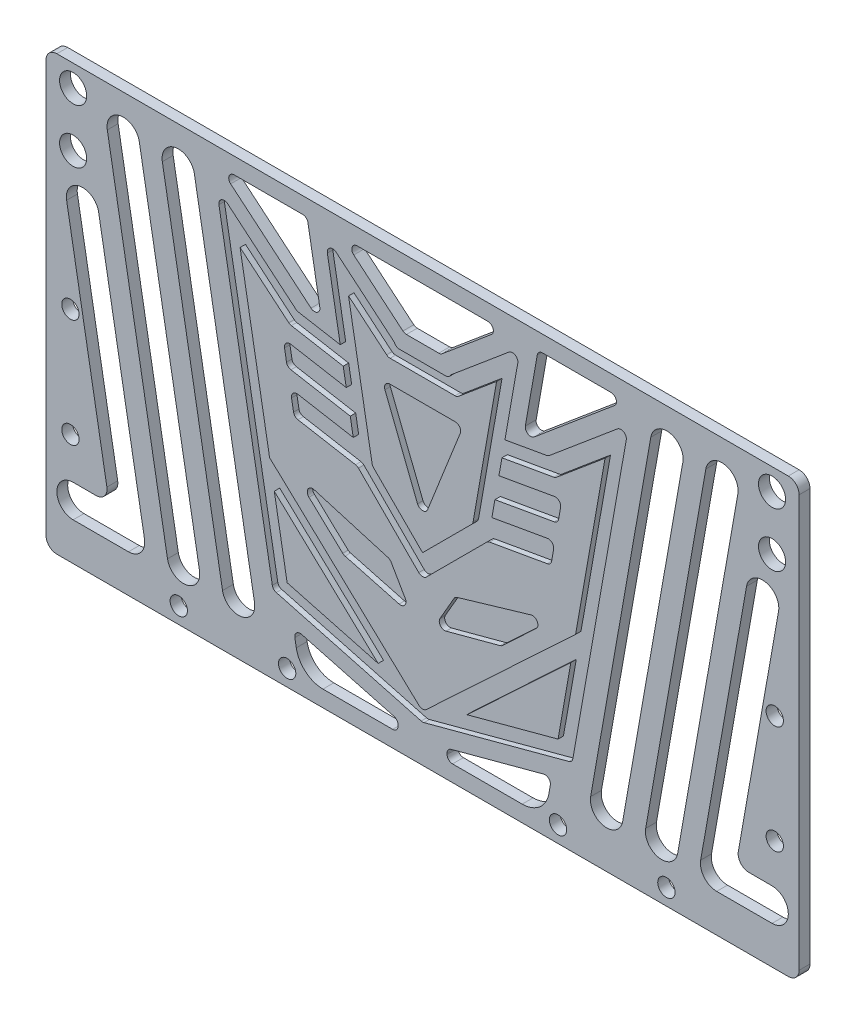
from build123d import *

# Parameters (mm, degrees)
SKETCH_1_W           = 139
SKETCH_1_H           = 80
EXTRUDE_1_DEPTH      = 2
SKETCH_2_R           = 1.6
CUT_EXTRUDE_1_DEPTH  = 10
CUT_EXTRUDE_4_DEPTH  = 10
CUT_EXTRUDE_6_DEPTH  = 10
SKETCH_12_R          = 2.5
CUT_EXTRUDE_7_DEPTH  = 10
FILLET_2_R           = 1
EXTRUDE_7_DEPTH      = 1
CUT_EXTRUDE_9_DEPTH  = 1
FILLET_6_R           = 1
FILLET_7_R           = 2
CUT_EXTRUDE_11_DEPTH = 10
FILLET_8_R           = 5
SKETCH_20_R          = 1.6
CUT_EXTRUDE_12_DEPTH = 10


with BuildPart() as part:
    # 草图1 → 凸台-拉伸1 (new body)
    with BuildSketch(Plane.XY):
        Rectangle(SKETCH_1_W, SKETCH_1_H)
    extrude(amount=EXTRUDE_1_DEPTH)

    # 草图2 → 切除-拉伸1 (cut)
    with BuildSketch(Plane(origin=(0, 0, 0), x_dir=(-1, 0, 0), z_dir=(0, 0, -1))):
        with Locations((-45, -37)):
            Circle(SKETCH_2_R)
        with Locations((-25, -37)):
            Circle(SKETCH_2_R)
        with Locations((25, -37)):
            Circle(SKETCH_2_R)
        with Locations((45, -37)):
            Circle(SKETCH_2_R)
    extrude(amount=-CUT_EXTRUDE_1_DEPTH, mode=Mode.SUBTRACT)

    # 草图8 → 切除-拉伸4 (cut)
    with BuildSketch(Plane.XY.offset(2)):
        Polygon((-2.050454401, -29.450582399), (-28.237299267, -4.94163371), (-27.369578226, -9.862724273), (-8.201817605, -27.802329596), align=None)
        Polygon((28.237299267, -4.94163371), (2.050454401, -29.450582399), (8.201817605, -27.802329596), (27.369578226, -9.862724273), align=None)
        Polygon((-6.000453282, -10.072058492), (-2, -17), (-14.557255853, -13.636173987), (-24.048690454, -4.752893669), align=None)
        Polygon((24.048690454, -4.752893669), (6.000453282, -10.072058492), (2, -17), (14.557255853, -13.636173987), align=None)
        Polygon((-12.056264909, 1.813624222), (-12.795435032, 6.005666305), (-24.436994042, 8.058387256), (-23.697823918, 3.866345173), align=None)
        Polygon((-13.349812625, 9.149697868), (-14.088982749, 13.341739952), (-25.730541758, 15.394460903), (-24.991371635, 11.202418819), align=None)
        Polygon((12.795435032, 6.005666305), (12.056264909, 1.813624222), (23.697823918, 3.866345173), (24.436994042, 8.058387256), align=None)
        Polygon((25.730541758, 15.394460903), (14.088982749, 13.341739952), (13.349812625, 9.149697868), (24.991371635, 11.202418819), align=None)
        Polygon((-11.5, 15.935200607), (-14.644031563, 16.4895782), (-14.088982749, 13.341739952), (-13.349812625, 9.149697868), (-12.795435032, 6.005666305), (-12.056264909, 1.813624222), (0, -10.242640687), (12.056264909, 1.813624222), (12.795435032, 6.005666305), (13.349812625, 9.149697868), (14.088982749, 13.341739952), (14.644031563, 16.4895782), (11.5, 15.935200607), (9.26609483, 3.26609483), (0, -6), (-9.26609483, 3.26609483), align=None)
        Polygon((-30.871912426, 10), (-33.682408883, 25.939117461), (-24.489875566, 18.225666145), (-14.644031563, 16.4895782), (-11.5, 15.935200607), (-12.054377593, 19.07923217), (-15.198409155, 19.633609762), (-23.177295707, 21.040502737), (-38.068115484, 33.53538412), (-33.918192262, 10), align=None)
        Polygon((33.682408883, 25.939117461), (30.871912426, 10), (33.918192262, 10), (38.068115484, 33.53538412), (23.177295707, 21.040502737), (15.198409155, 19.633609762), (12.054377593, 19.07923217), (11.5, 15.935200607), (14.644031563, 16.4895782), (24.489875566, 18.225666145), align=None)
        Polygon((-2.050454401, -32.55641094), (-2.050454401, -29.450582399), (-8.201817605, -27.802329596), (-25, -23.301270189), (-24.425201305, -26.561115577), align=None)
        Polygon((8.201817605, -27.802329596), (2.050454401, -29.450582399), (2.050454401, -32.55641094), (24.425201305, -26.561115577), (25, -23.301270189), align=None)
        Polygon((-27.369578226, -9.862724273), (-28.237299267, -4.94163371), (-31.885665318, -1.527033105), (-29.157363783, -17), (-26.111083947, -17), align=None)
        Polygon((31.885665318, -1.527033105), (28.237299267, -4.94163371), (27.369578226, -9.862724273), (26.111083947, -17), (29.157363783, -17), align=None)
        Polygon((-15.198409155, 19.633609762), (-12.054377593, 19.07923217), (-13.663442353, 28.20469189), (-5, 20.935200607), (-5, 24.851422475), (-18.049148953, 35.800958548), align=None)
        Polygon((5, 24.851422475), (5, 20.935200607), (13.663442353, 28.20469189), (12.054377593, 19.07923217), (15.198409155, 19.633609762), (18.049148953, 35.800958548), align=None)
    extrude(amount=-CUT_EXTRUDE_4_DEPTH, mode=Mode.SUBTRACT)

    # 草图10 → 切除-拉伸6 (cut)
    with BuildSketch(Plane.XY.offset(2)):
        Polygon((-7.5, 17.935200607), (7.5, 17.935200607), (0, -1), align=None)
    extrude(amount=-CUT_EXTRUDE_6_DEPTH, mode=Mode.SUBTRACT)

    # 草图12 → 切除-拉伸7 (cut)
    with BuildSketch(Plane(origin=(0, 0, 0), x_dir=(-1, 0, 0), z_dir=(0, 0, -1))):
        with BuildLine():
            ThreePointArc((59.790903369, 18.520944533), (63.266271161, 20.954423259), (65.699749887, 17.479055467))
            Line((65.699749887, 17.479055467), (57.856892332, -27))
            Line((57.856892332, -27), (64.5, -27))
            ThreePointArc((64.5, -27), (67.5, -30), (64.5, -33))
            Line((64.5, -33), (54.281631554, -33))
            ThreePointArc((54.281631554, -33), (51.983498225, -31.928362829), (51.327208295, -29.479055467))
            Line((51.327208295, -29.479055467), (59.790903369, 18.520944533))
        make_face()
        with BuildLine():
            ThreePointArc((47.081788695, -30.520944533), (43.606420903, -32.954423259), (41.172942177, -29.479055467))
            Line((41.172942177, -29.479055467), (52.281541961, 33.520944533))
            ThreePointArc((52.281541961, 33.520944533), (55.756909753, 35.954423259), (58.190388479, 32.479055467))
            Line((58.190388479, 32.479055467), (47.081788695, -30.520944533))
        make_face()
        with BuildLine():
            ThreePointArc((36.927522576, -30.520944533), (33.452154784, -32.954423259), (31.018676058, -29.479055467))
            Line((31.018676058, -29.479055467), (42.127275842, 33.520944533))
            ThreePointArc((42.127275842, 33.520944533), (45.602643634, 35.954423259), (48.03612236, 32.479055467))
            Line((48.03612236, 32.479055467), (36.927522576, -30.520944533))
        make_face()
        with Locations((64.5, 36)):
            Circle(SKETCH_12_R)
        with Locations((64.5, 26)):
            Circle(SKETCH_12_R)
        with BuildLine():
            Line((-58.190388479, 32.479055467), (-47.081788695, -30.520944533))
            ThreePointArc((-47.081788695, -30.520944533), (-43.606420903, -32.954423259), (-41.172942177, -29.479055467))
            Line((-41.172942177, -29.479055467), (-52.281541961, 33.520944533))
            ThreePointArc((-52.281541961, 33.520944533), (-55.756909753, 35.954423259), (-58.190388479, 32.479055467))
        make_face()
        with BuildLine():
            Line((-48.03612236, 32.479055467), (-36.927522576, -30.520944533))
            ThreePointArc((-36.927522576, -30.520944533), (-33.452154784, -32.954423259), (-31.018676058, -29.479055467))
            Line((-31.018676058, -29.479055467), (-42.127275842, 33.520944533))
            ThreePointArc((-42.127275842, 33.520944533), (-45.602643634, 35.954423259), (-48.03612236, 32.479055467))
        make_face()
        with Locations((-64.5, 26)):
            Circle(SKETCH_12_R)
        with Locations((-64.5, 36)):
            Circle(SKETCH_12_R)
        with BuildLine():
            Line((-57.856892332, -27), (-64.5, -27))
            ThreePointArc((-64.5, -27), (-67.5, -30), (-64.5, -33))
            Line((-64.5, -33), (-54.281631554, -33))
            ThreePointArc((-54.281631554, -33), (-51.983498225, -31.928362829), (-51.327208295, -29.479055467))
            Line((-51.327208295, -29.479055467), (-59.790903369, 18.520944533))
            ThreePointArc((-59.790903369, 18.520944533), (-63.266271161, 20.954423259), (-65.699749887, 17.479055467))
            Line((-65.699749887, 17.479055467), (-57.856892332, -27))
        make_face()
    extrude(amount=-CUT_EXTRUDE_7_DEPTH, mode=Mode.SUBTRACT)

    # 圆角2
    fillet_2_edges = [part.edges().sort_by_distance(p)[0] for p in [
        (-23.697823918, 3.866345173, 1),
        (-24.436994042, 8.058387256, 1),
        (-24.991371635, 11.202418819, 1),
        (-25.730541758, 15.394460903, 1),
        (-24.489875566, 18.225666145, 1),
        (-30.871912426, 10, 1),
        (-33.918192262, 10, 1),
        (-38.068115484, 33.53538412, 1),
        (-23.177295707, 21.040502737, 1),
        (-18.049148953, 35.800958548, 1),
        (-5, 24.851422475, 1),
        (-5, 20.935200607, 1),
        (5, 20.935200607, 1),
        (5, 24.851422475, 1),
        (18.049148953, 35.800958548, 1),
        (23.177295707, 21.040502737, 1),
        (38.068115484, 33.53538412, 1),
        (33.918192262, 10, 1),
        (30.871912426, 10, 1),
        (24.489875566, 18.225666145, 1),
        (25.730541758, 15.394460903, 1),
        (24.991371635, 11.202418819, 1),
        (24.436994042, 8.058387256, 1),
        (23.697823918, 3.866345173, 1),
        (0, -10.242640687, 1),
        (-6.000453282, -10.072058492, 1),
        (-2, -17, 1),
        (-14.557255853, -13.636173987, 1),
        (-24.048690454, -4.752893669, 1),
        (0, -1, 1),
        (-7.5, 17.935200607, 1),
        (7.5, 17.935200607, 1),
        (6.000453282, -10.072058492, 1),
        (24.048690454, -4.752893669, 1),
        (14.557255853, -13.636173987, 1),
        (2, -17, 1),
    ]]
    fillet(fillet_2_edges, radius=FILLET_2_R)

    # 草图16 → 凸台-拉伸7 (add)
    with BuildSketch(Plane(origin=(0, 0, 0), x_dir=(-1, 0, 0), z_dir=(0, 0, -1))):
        with BuildLine():
            Line((5.800571497, -10.418211594), (3.207243571, -14.909308706))
            ThreePointArc((3.207243571, -14.909308706), (3.279843092, -16.018074888), (4.331992107, -16.375308125))
            Line((4.331992107, -16.375308125), (14.315451156, -13.700948405))
            ThreePointArc((14.315451156, -13.700948405), (14.54227261, -13.609199381), (14.740024564, -13.465116001))
            Line((14.740024564, -13.465116001), (20.970078747, -7.634246376))
            ThreePointArc((20.970078747, -7.634246376), (21.154837345, -6.407725426), (20.004052, -5.944926906))
            Line((20.004052, -5.944926906), (6.383866693, -9.959059138))
            ThreePointArc((6.383866693, -9.959059138), (6.048035668, -10.132505903), (5.800571497, -10.418211594))
        make_face()
        Polygon((8.201817605, -27.802329596), (27.369578226, -9.862724273), (26.111083947, -17), (29.157363783, -17), (31.885665318, -1.527033105), (2.050454401, -29.450582399), (2.050454401, -32.55641094), (24.425201305, -26.561115577), (25, -23.301270189), align=None)
        with BuildLine():
            Line((-14.315451156, -13.700948405), (-4.331992107, -16.375308125))
            ThreePointArc((-4.331992107, -16.375308125), (-3.279843092, -16.018074888), (-3.207243571, -14.909308706))
            Line((-3.207243571, -14.909308706), (-5.800571497, -10.418211594))
            ThreePointArc((-5.800571497, -10.418211594), (-6.048035668, -10.132505903), (-6.383866693, -9.959059138))
            Line((-6.383866693, -9.959059138), (-20.004052, -5.944926906))
            ThreePointArc((-20.004052, -5.944926906), (-21.154837345, -6.407725426), (-20.970078747, -7.634246376))
            Line((-20.970078747, -7.634246376), (-14.740024564, -13.465116001))
            ThreePointArc((-14.740024564, -13.465116001), (-14.54227261, -13.609199381), (-14.315451156, -13.700948405))
        make_face()
        with BuildLine():
            Line((-6.958051862, 16.566947711), (-0.929725661, 1.347272253))
            ThreePointArc((-0.929725661, 1.347272253), (0, 0.715525149), (0.929725661, 1.347272253))
            Line((0.929725661, 1.347272253), (6.958051862, 16.566947711))
            ThreePointArc((6.958051862, 16.566947711), (6.855445568, 17.497226898), (6.028326201, 17.935200607))
            Line((6.028326201, 17.935200607), (-6.028326201, 17.935200607))
            ThreePointArc((-6.028326201, 17.935200607), (-6.855445568, 17.497226898), (-6.958051862, 16.566947711))
        make_face()
        Polygon((-2.050454401, -29.450582399), (-31.885665318, -1.527033105), (-29.157363783, -17), (-26.111083947, -17), (-27.369578226, -9.862724273), (-8.201817605, -27.802329596), (-25, -23.301270189), (-24.425201305, -26.561115577), (-2.050454401, -32.55641094), align=None)
        with BuildLine():
            Line((22.913417264, 20.993973848), (15.198409155, 19.633609762))
            Line((15.198409155, 19.633609762), (17.572054506, 33.095221485))
            ThreePointArc((17.572054506, 33.095221485), (17.087246753, 34.134895066), (15.944459143, 34.034914105))
            Line((15.944459143, 34.034914105), (5.35721239, 25.15115926))
            ThreePointArc((5.35721239, 25.15115926), (5.093692213, 24.807733078), (5, 24.385114817))
            Line((5, 24.385114817), (5, 23.079707527))
            ThreePointArc((5, 23.079707527), (5.577381738, 22.17339974), (6.64278761, 22.313663084))
            Line((6.64278761, 22.313663084), (13.663442353, 28.20469189))
            Line((13.663442353, 28.20469189), (9.26609483, 3.26609483))
            Line((9.26609483, 3.26609483), (0, -6))
            Line((0, -6), (-9.26609483, 3.26609483))
            Line((-9.26609483, 3.26609483), (-13.663442353, 28.20469189))
            Line((-13.663442353, 28.20469189), (-6.64278761, 22.313663084))
            ThreePointArc((-6.64278761, 22.313663084), (-5.577381738, 22.17339974), (-5, 23.079707527))
            Line((-5, 23.079707527), (-5, 24.385114817))
            ThreePointArc((-5, 24.385114817), (-5.093692213, 24.807733078), (-5.35721239, 25.15115926))
            Line((-5.35721239, 25.15115926), (-15.944459143, 34.034914105))
            ThreePointArc((-15.944459143, 34.034914105), (-17.087246753, 34.134895066), (-17.572054506, 33.095221485))
            Line((-17.572054506, 33.095221485), (-15.198409155, 19.633609762))
            Line((-15.198409155, 19.633609762), (-22.913417264, 20.993973848))
            ThreePointArc((-22.913417264, 20.993973848), (-23.162387349, 21.072473814), (-23.382556696, 21.212737158))
            Line((-23.382556696, 21.212737158), (-35.963425674, 31.769339677))
            ThreePointArc((-35.963425674, 31.769339677), (-37.106213284, 31.869320638), (-37.591021037, 30.829647056))
            Line((-37.591021037, 30.829647056), (-34.063900384, 10.826351822))
            ThreePointArc((-34.063900384, 10.826351822), (-33.72188024, 10.233955557), (-33.079092631, 10))
            Line((-33.079092631, 10), (-32.063666019, 10))
            ThreePointArc((-32.063666019, 10), (-31.297621576, 10.35721239), (-31.078858266, 11.173648178))
            Line((-31.078858266, 11.173648178), (-33.682408883, 25.939117461))
            Line((-33.682408883, 25.939117461), (-24.695136556, 18.397900566))
            ThreePointArc((-24.695136556, 18.397900566), (-24.474967208, 18.257637222), (-24.225997124, 18.179137256))
            Line((-24.225997124, 18.179137256), (-14.644031563, 16.4895782))
            Line((-14.644031563, 16.4895782), (-14.088982749, 13.341739952))
            Line((-14.088982749, 13.341739952), (-24.324090529, 15.146465604))
            ThreePointArc((-24.324090529, 15.146465604), (-25.204845488, 14.868764632), (-25.48254646, 13.988009673))
            Line((-25.48254646, 13.988009673), (-25.112961398, 11.891988631))
            ThreePointArc((-25.112961398, 11.891988631), (-24.835260426, 11.358530028), (-24.301801822, 11.080829056))
            Line((-24.301801822, 11.080829056), (-13.349812625, 9.149697868))
            Line((-13.349812625, 9.149697868), (-12.795435032, 6.005666305))
            Line((-12.795435032, 6.005666305), (-23.030542813, 7.810391957))
            ThreePointArc((-23.030542813, 7.810391957), (-23.911297771, 7.532690986), (-24.188998743, 6.651936027))
            Line((-24.188998743, 6.651936027), (-23.819413681, 4.555914985))
            ThreePointArc((-23.819413681, 4.555914985), (-23.54171271, 4.022456381), (-23.008254106, 3.74475541))
            Line((-23.008254106, 3.74475541), (-12.056264909, 1.813624222))
            Line((-12.056264909, 1.813624222), (-0.707106781, -9.535533906))
            ThreePointArc((-0.707106781, -9.535533906), (0, -9.828427125), (0.707106781, -9.535533906))
            Line((0.707106781, -9.535533906), (12.056264909, 1.813624222))
            Line((12.056264909, 1.813624222), (23.008254106, 3.74475541))
            ThreePointArc((23.008254106, 3.74475541), (23.54171271, 4.022456381), (23.819413681, 4.555914985))
            Line((23.819413681, 4.555914985), (24.188998743, 6.651936027))
            ThreePointArc((24.188998743, 6.651936027), (23.911297771, 7.532690986), (23.030542813, 7.810391957))
            Line((23.030542813, 7.810391957), (12.795435032, 6.005666305))
            Line((12.795435032, 6.005666305), (13.349812625, 9.149697868))
            Line((13.349812625, 9.149697868), (24.301801822, 11.080829056))
            ThreePointArc((24.301801822, 11.080829056), (24.835260426, 11.358530028), (25.112961398, 11.891988631))
            Line((25.112961398, 11.891988631), (25.48254646, 13.988009673))
            ThreePointArc((25.48254646, 13.988009673), (25.204845488, 14.868764632), (24.324090529, 15.146465604))
            Line((24.324090529, 15.146465604), (14.088982749, 13.341739952))
            Line((14.088982749, 13.341739952), (14.644031563, 16.4895782))
            Line((14.644031563, 16.4895782), (24.225997124, 18.179137256))
            ThreePointArc((24.225997124, 18.179137256), (24.474967208, 18.257637222), (24.695136556, 18.397900566))
            Line((24.695136556, 18.397900566), (33.682408883, 25.939117461))
            Line((33.682408883, 25.939117461), (31.078858266, 11.173648178))
            ThreePointArc((31.078858266, 11.173648178), (31.297621576, 10.35721239), (32.063666019, 10))
            Line((32.063666019, 10), (33.079092631, 10))
            ThreePointArc((33.079092631, 10), (33.72188024, 10.233955557), (34.063900384, 10.826351822))
            Line((34.063900384, 10.826351822), (37.591021037, 30.829647056))
            ThreePointArc((37.591021037, 30.829647056), (37.106213284, 31.869320638), (35.963425674, 31.769339677))
            Line((35.963425674, 31.769339677), (23.382556696, 21.212737158))
            ThreePointArc((23.382556696, 21.212737158), (23.162387349, 21.072473814), (22.913417264, 20.993973848))
        make_face()
    extrude(amount=-EXTRUDE_7_DEPTH)

    # 草图17 → 切除-拉伸9 (cut)
    with BuildSketch(Plane.XY.offset(2)):
        Polygon((-33.682408883, 25.939117461), (-36.636832142, 25.418172928), (-27.62254499, -25.704389918), (-24.425201305, -26.561115577), align=None)
        Polygon((2.050454401, -29.450582399), (0, -31.369655963), (-2.050454401, -29.450582399), (-2.050454401, -32.55641094), (0, -33.105828541), (2.050454401, -32.55641094), align=None)
        Polygon((-6, 22.079707527), (6, 22.079707527), (6, 24.385114817), (5, 24.385114817), (-5, 24.385114817), (-6, 24.385114817), align=None)
        Polygon((24.425201305, -26.561115577), (33.682408883, 25.939117461), (36.636832142, 25.418172928), (27.62254499, -25.704389918), align=None)
    extrude(amount=-CUT_EXTRUDE_9_DEPTH, mode=Mode.SUBTRACT)

    # 圆角6
    fillet_6_edges = [part.edges().sort_by_distance(p)[0] for p in [
        (-27.62254499, -25.704389918, 1.5),
        (0, -33.105828541, 1.5),
        (0, -31.369655963, 1.5),
        (27.62254499, -25.704389918, 1.5),
        (-5, 24.385114817, 1.5),
        (5, 24.385114817, 1.5),
        (-12.056264909, 1.813624222, 1.5),
        (12.056264909, 1.813624222, 1.5),
        (9.26609483, 3.26609483, 1.5),
        (-9.26609483, 3.26609483, 1.5),
    ]]
    fillet(fillet_6_edges, radius=FILLET_6_R)

    # 圆角7
    fillet_7_edges = [part.edges().sort_by_distance(p)[0] for p in [
        (57.856892332, -27, 1),
        (-57.856892332, -27, 1),
        (69.5, -40, 1),
        (-69.5, -40, 1),
        (-69.5, 40, 1),
        (69.5, 40, 1),
    ]]
    fillet(fillet_7_edges, radius=FILLET_7_R)

    # 草图19 → 切除-拉伸11 (cut)
    with BuildSketch(Plane.XY.offset(2)):
        with BuildLine():
            Line((-21.161144026, 36.173648178), (-18.966841741, 23.729141525))
            ThreePointArc((-18.966841741, 23.729141525), (-19.451649494, 22.689467944), (-20.594437104, 22.789448904))
            Line((-20.594437104, 22.789448904), (-35.425222615, 35.233955557))
            ThreePointArc((-35.425222615, 35.233955557), (-35.722127626, 36.342020143), (-34.782435005, 37))
            Line((-34.782435005, 37), (-22.145951779, 37))
            ThreePointArc((-22.145951779, 37), (-21.503164169, 36.766044443), (-21.161144026, 36.173648178))
        make_face()
        with BuildLine():
            Line((-12.70624962, 35.233955557), (-3.631182846, 27.619070374))
            ThreePointArc((-3.631182846, 27.619070374), (-3.330415379, 27.445422196), (-2.988395236, 27.385114817))
            Line((-2.988395236, 27.385114817), (2.988395236, 27.385114817))
            ThreePointArc((2.988395236, 27.385114817), (3.330415379, 27.445422196), (3.631182846, 27.619070374))
            Line((3.631182846, 27.619070374), (12.70624962, 35.233955557))
            ThreePointArc((12.70624962, 35.233955557), (13.003154631, 36.342020143), (12.06346201, 37))
            Line((12.06346201, 37), (-12.06346201, 37))
            ThreePointArc((-12.06346201, 37), (-13.003154631, 36.342020143), (-12.70624962, 35.233955557))
        make_face()
        with BuildLine():
            Line((20.594437104, 22.789448904), (35.425222615, 35.233955557))
            ThreePointArc((35.425222615, 35.233955557), (35.722127626, 36.342020143), (34.782435005, 37))
            Line((34.782435005, 37), (22.145951779, 37))
            ThreePointArc((22.145951779, 37), (21.503164169, 36.766044443), (21.161144026, 36.173648178))
            Line((21.161144026, 36.173648178), (18.966841741, 23.729141525))
            ThreePointArc((18.966841741, 23.729141525), (19.451649494, 22.689467944), (20.594437104, 22.789448904))
        make_face()
        with BuildLine():
            Line((-22.584544333, -37), (-23.577829571, -31.36679949))
            ThreePointArc((-23.577829571, -31.36679949), (-23.268612025, -30.455873975), (-22.334202772, -30.227225486))
            Line((-22.334202772, -30.227225486), (-5.263146748, -34.801401162))
            ThreePointArc((-5.263146748, -34.801401162), (-4.728612453, -35.158565559), (-4.521965793, -35.767326988))
            Line((-4.521965793, -35.767326988), (-4.521965793, -36))
            ThreePointArc((-4.521965793, -36), (-4.814859012, -36.707106781), (-5.521965793, -37))
            Line((-5.521965793, -37), (-22.584544333, -37))
        make_face()
        with BuildLine():
            Line((4.521965793, -36), (4.521965793, -35.767326988))
            ThreePointArc((4.521965793, -35.767326988), (4.728612453, -35.158565559), (5.263146748, -34.801401162))
            Line((5.263146748, -34.801401162), (22.334202772, -30.227225486))
            ThreePointArc((22.334202772, -30.227225486), (23.268612025, -30.455873975), (23.577829571, -31.36679949))
            Line((23.577829571, -31.36679949), (22.584544333, -37))
            Line((22.584544333, -37), (5.521965793, -37))
            ThreePointArc((5.521965793, -37), (4.814859012, -36.707106781), (4.521965793, -36))
        make_face()
    extrude(amount=-CUT_EXTRUDE_11_DEPTH, mode=Mode.SUBTRACT)

    # 圆角8
    fillet_8_edges = [part.edges().sort_by_distance(p)[0] for p in [
        (-22.584544333, -37, 1),
        (22.584544333, -37, 1),
    ]]
    fillet(fillet_8_edges, radius=FILLET_8_R)

    # 草图20 → 切除-拉伸12 (cut)
    with BuildSketch(Plane(origin=(0, 0, 0), x_dir=(-1, 0, 0), z_dir=(0, 0, -1))):
        with Locations((-65, 0.408965344)):
            Circle(SKETCH_20_R)
        with Locations((-65, -19.591034656)):
            Circle(SKETCH_20_R)
        with Locations(Location((65, -19.591034656, 0), (0, 0, 180))):
            Circle(SKETCH_20_R)
        with Locations(Location((65, 0.408965344, 0), (0, 0, 180))):
            Circle(SKETCH_20_R)
    extrude(amount=-CUT_EXTRUDE_12_DEPTH, mode=Mode.SUBTRACT)


solid = part.part
